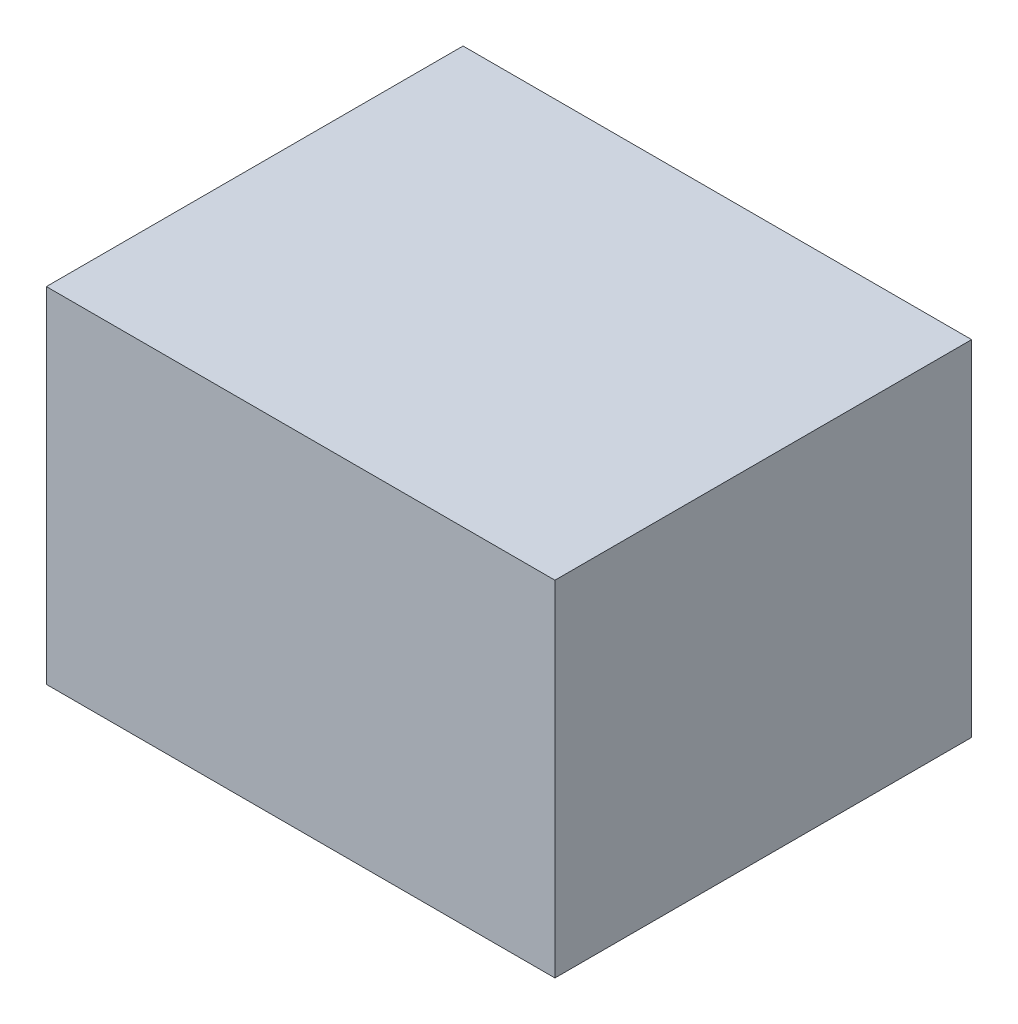
from build123d import *

# Parameters (mm, degrees)
CROQUIS1_W              = 15.5
CROQUIS1_H              = 12.7
SALIENTE_EXTRUIR1_DEPTH = 5.25


with BuildPart() as part:
    # Croquis1 → Saliente-Extruir1 (new, symmetric)
    with BuildSketch(Plane(origin=(0, 0, 0), x_dir=(1, 0, 0), z_dir=(0, 1, 0))):
        Rectangle(CROQUIS1_W, CROQUIS1_H)
    extrude(amount=SALIENTE_EXTRUIR1_DEPTH, both=True)


solid = part.part
